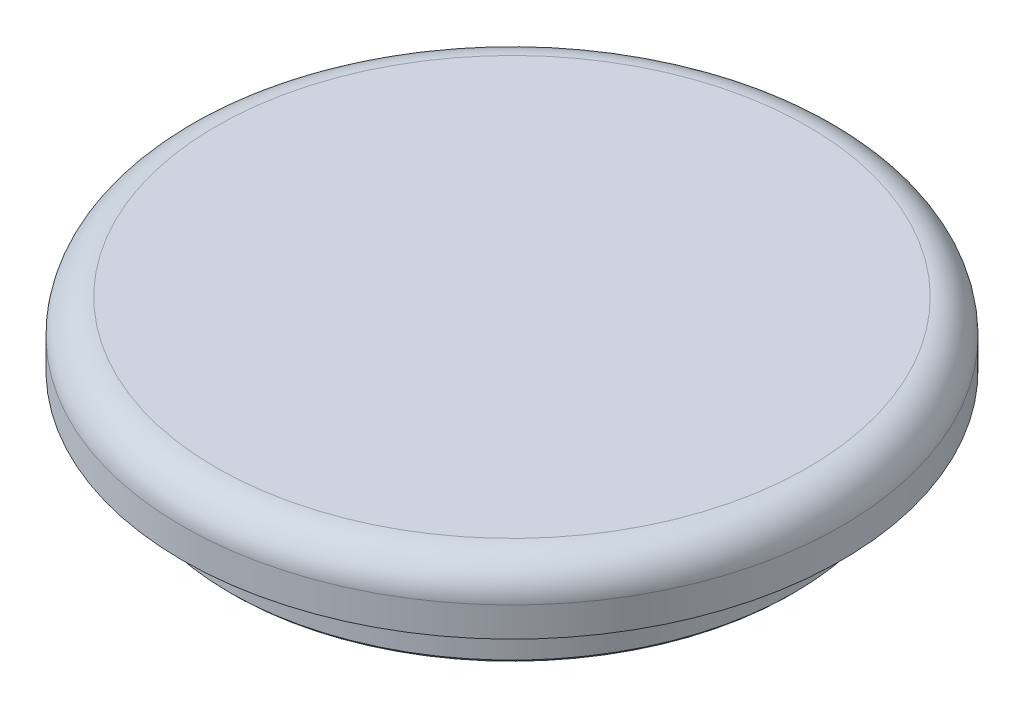
from build123d import *

# Parameters (mm, degrees)
SKETCH1_R     = 49.53
BODY_DEPTH    = 9.525
SKETCH2_R     = 42.426526601
SKETCH2_R_2   = 36.076526601
FLANGE_DEPTH  = 8.255
FILLET1_R     = 5.08
CHAMFER1_SIZE = 0.508


with BuildPart() as part:
    # Sketch1 → body (new body)
    with BuildSketch(Plane(origin=(0, 0, 0), x_dir=(1, 0, 0), z_dir=(0, 1, 0))):
        with Locations(Location((0, 0, 0), (0, 0, 90))):
            Circle(SKETCH1_R)
    extrude(amount=BODY_DEPTH)

    # Sketch2 → flange (add)
    with BuildSketch(Plane.XZ):
        with Locations(Location((0, 0, 0), (0, 0, 90))):
            Circle(SKETCH2_R)
        with Locations(Location((0, 0, 0), (0, 0, 270))):
            Circle(SKETCH2_R_2, mode=Mode.SUBTRACT)
    extrude(amount=FLANGE_DEPTH)

    # Fillet1
    fillet1_edges = [part.edges().sort_by_distance(p)[0] for p in [
        (0, 9.525, 49.53),
    ]]
    fillet(fillet1_edges, radius=FILLET1_R)

    # Chamfer1
    chamfer1_edges = [part.edges().sort_by_distance(p)[0] for p in [
        (0, -8.255, -42.426526601),
        (0, -8.255, 36.076526601),
    ]]
    chamfer(chamfer1_edges, length=CHAMFER1_SIZE)


solid = part.part
